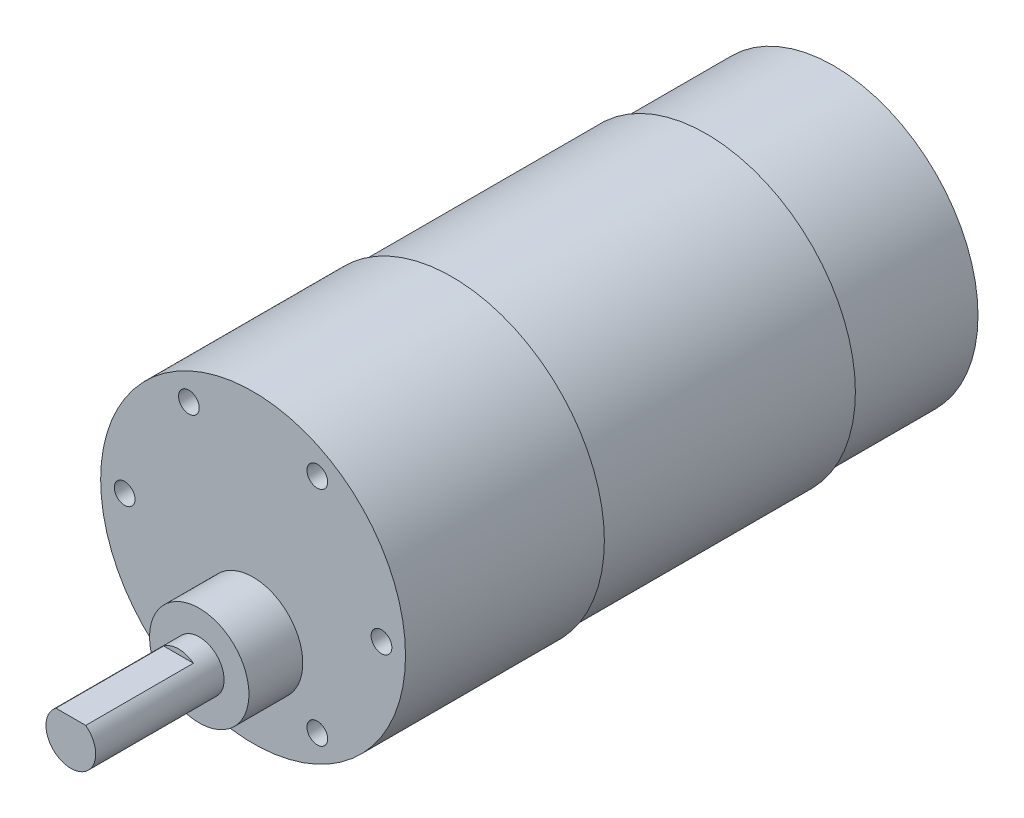
from build123d import *

# Parameters (mm, degrees)
SKETCH1_R                       = 17.4
BOSS_EXTRUDE1_DEPTH             = 15.4
SKETCH2_R                       = 18
BOSS_EXTRUDE2_DEPTH             = 30.7
SKETCH3_R                       = 18.4
BOSS_EXTRUDE3_DEPTH             = 24
SKETCH4_R                       = 6
BOSS_EXTRUDE4_DEPTH             = 6.5
SKETCH5_R                       = 3
BOSS_EXTRUDE5_DEPTH             = 15.5
CUT_EXTRUDE1_START              = -13
CUT_EXTRUDE1_DEPTH              = 13
TAP_DRILL_FOR_M3X0_5_TAP1_D     = 2.5
TAP_DRILL_FOR_M3X0_5_TAP1_DEPTH = 10.76


with BuildPart() as part:
    # Sketch1 → Boss-Extrude1 (new body)
    with BuildSketch(Plane.XY):
        with Locations(Location((0, 0, 0), (0, 0, 180))):
            Circle(SKETCH1_R)
    extrude(amount=BOSS_EXTRUDE1_DEPTH)

    # Sketch2 → Boss-Extrude2 (add)
    with BuildSketch(Plane.XY.offset(15.4)):
        Circle(SKETCH2_R)
    extrude(amount=BOSS_EXTRUDE2_DEPTH)

    # Sketch3 → Boss-Extrude3 (add)
    with BuildSketch(Plane.XY.offset(46.1)):
        Circle(SKETCH3_R)
    extrude(amount=BOSS_EXTRUDE3_DEPTH)

    # Sketch4 → Boss-Extrude4 (add)
    with BuildSketch(Plane.XY.offset(70.1)):
        with Locations(Location((0, -7, 0), (0, 0, 180))):
            Circle(SKETCH4_R)
    extrude(amount=BOSS_EXTRUDE4_DEPTH)

    # Sketch5 → Boss-Extrude5 (add)
    with BuildSketch(Plane.XY.offset(76.6)):
        with Locations((0, -7)):
            Circle(SKETCH5_R)
    extrude(amount=BOSS_EXTRUDE5_DEPTH)

    # Sketch6 → Cut-Extrude1 (cut)
    with BuildSketch(Plane.XY.offset(92.1).offset(CUT_EXTRUDE1_START)):
        with BuildLine():
            Line((-1.8, -4.6), (1.8, -4.6))
            ThreePointArc((1.8, -4.6), (0, -4), (-1.8, -4.6))
        make_face()
    extrude(amount=CUT_EXTRUDE1_DEPTH, mode=Mode.SUBTRACT)

    # Tap Drill for M3x0.5 Tap1
    with Locations(Plane.XY.offset(70.1)):
        with Locations((-15.5, 0), (-7.75, 13.423393759), (7.75, 13.423393759), (15.5, 0), (7.75, -13.423393759), (-7.75, -13.423393759)):
            Hole(TAP_DRILL_FOR_M3X0_5_TAP1_D / 2, depth=TAP_DRILL_FOR_M3X0_5_TAP1_DEPTH)


solid = part.part
